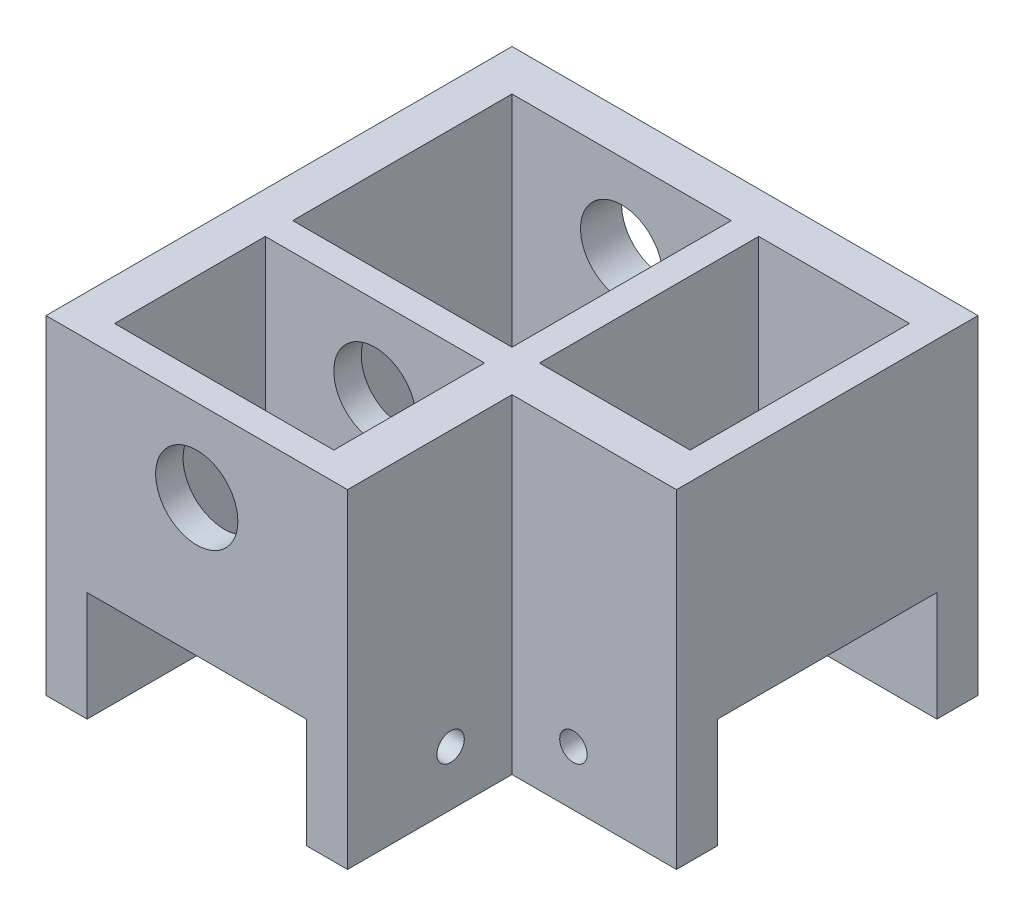
from build123d import *

# Parameters (mm, degrees)
SKETCH1_W               = 139.7
SKETCH1_H               = 139.7
SKETCH1_W_2             = 101.6
SKETCH1_H_2             = 101.6
EXTRUDE_THIN1_DEPTH     = 152.4
CUT_EXTRUDE2_START      = -50.8
SKETCH3_W               = 19.05
SKETCH3_H               = 101.6
CUT_EXTRUDE2_DEPTH      = 50.8
BOSS_EXTRUDE2_DEPTH     = 76.2
SKETCH6_W               = 69.85
SKETCH6_H               = 101.6
CUT_EXTRUDE3_DEPTH      = 223.34069578
SKETCH8_R               = 6.35
CUT_EXTRUDE4_DEPTH      = 254.125369136
SKETCH9_W               = 215.9
SKETCH9_H               = 152.4
CUT_EXTRUDE5_DEPTH      = 304.76371755
CUT_EXTRUDE6_DEPTH      = 355.386895074
CUT_EXTRUDE6_DEPTH_BACK = 355.386895074
SKETCH11_R              = 19.05


with BuildPart() as part:
    # Sketch1 → Extrude-Thin1 (new body)
    with BuildSketch(Plane(origin=(0, 0, 0), x_dir=(1, 0, 0), z_dir=(0, 1, 0))):
        Rectangle(SKETCH1_W, SKETCH1_H)
        Rectangle(SKETCH1_W_2, SKETCH1_H_2, mode=Mode.SUBTRACT)
    extrude(amount=EXTRUDE_THIN1_DEPTH)

    # Sketch3 → Cut-Extrude2 (cut)
    with BuildSketch(Plane.XZ.offset(CUT_EXTRUDE2_START)):
        with Locations((-60.325, 0)):
            Rectangle(SKETCH3_W, SKETCH3_H)
    cut_extrude2 = extrude(amount=CUT_EXTRUDE2_DEPTH, mode=Mode.SUBTRACT)

    # Sketch5 → Boss-Extrude2 (add)
    with BuildSketch(Plane.ZY.offset(69.85)):
        Polygon((-50.8, 50.8), (50.8, 50.8), (50.8, 0), (69.85, 0), (69.85, 152.4), (-69.85, 152.4), (-69.85, 0), (-50.8, 0), align=None)
    boss_extrude2 = extrude(amount=BOSS_EXTRUDE2_DEPTH)

    # Sketch6 → Cut-Extrude3 (cut, through all)
    with BuildSketch(Plane(origin=(0, 152.4, 0), x_dir=(1, 0, 0), z_dir=(0, 1, 0))):
        with Locations((-98.425, 0)):
            Rectangle(SKETCH6_W, SKETCH6_H)
    cut_extrude3 = extrude(amount=-CUT_EXTRUDE3_DEPTH, mode=Mode.SUBTRACT)

    # Sketch8 → Cut-Extrude4 (cut, through all)
    with BuildSketch(Plane.XY.offset(69.85)):
        with Locations((-98.298, 25.4)):
            Circle(SKETCH8_R)
    cut_extrude4 = extrude(amount=-CUT_EXTRUDE4_DEPTH, mode=Mode.SUBTRACT)

    # Mirror3: Cut-Extrude2, Boss-Extrude2, Cut-Extrude3, Cut-Extrude4 across plane
    add(cut_extrude2.mirror(Plane(origin=(0, 0, 0), x_dir=(-0.7071067811865476, 0, 0.7071067811865476), z_dir=(-0.7071067811865477, 0, -0.7071067811865475))), mode=Mode.SUBTRACT)
    add(boss_extrude2.mirror(Plane(origin=(0, 0, 0), x_dir=(-0.7071067811865476, 0, 0.7071067811865476), z_dir=(-0.7071067811865477, 0, -0.7071067811865475))))
    add(cut_extrude3.mirror(Plane(origin=(0, 0, 0), x_dir=(-0.7071067811865476, 0, 0.7071067811865476), z_dir=(-0.7071067811865477, 0, -0.7071067811865475))), mode=Mode.SUBTRACT)
    add(cut_extrude4.mirror(Plane(origin=(0, 0, 0), x_dir=(-0.7071067811865476, 0, 0.7071067811865476), z_dir=(-0.7071067811865477, 0, -0.7071067811865475))), mode=Mode.SUBTRACT)


with BuildPart() as body_2:
    # Mirror5: mirrored copy
    add(part.part.mirror(Plane(origin=(72.39, 0, 0), x_dir=(0, 0, 1), z_dir=(1, 0, 0))))

    # Sketch11 → Cut-Extrude6 (cut, two sides: drawn at the far end of the back side and taken through both)
    with BuildSketch(Plane.XY.offset(63.5).offset(-CUT_EXTRUDE6_DEPTH_BACK)):
        with Locations((144.78, 114.3)):
            Circle(SKETCH11_R)
    extrude(amount=CUT_EXTRUDE6_DEPTH + CUT_EXTRUDE6_DEPTH_BACK, mode=Mode.SUBTRACT)


with BuildPart() as part_1:
    add(part.part)

    # Sketch9 → Cut-Extrude5 (cut, through all)
    with BuildSketch(Plane(origin=(72.39, 0, 0), x_dir=(0, 0, -1), z_dir=(1, 0, 0))):
        with Locations((-38.1, 76.2)):
            Rectangle(SKETCH9_W, SKETCH9_H)
    extrude(amount=-CUT_EXTRUDE5_DEPTH, mode=Mode.SUBTRACT)


solid = body_2.part
